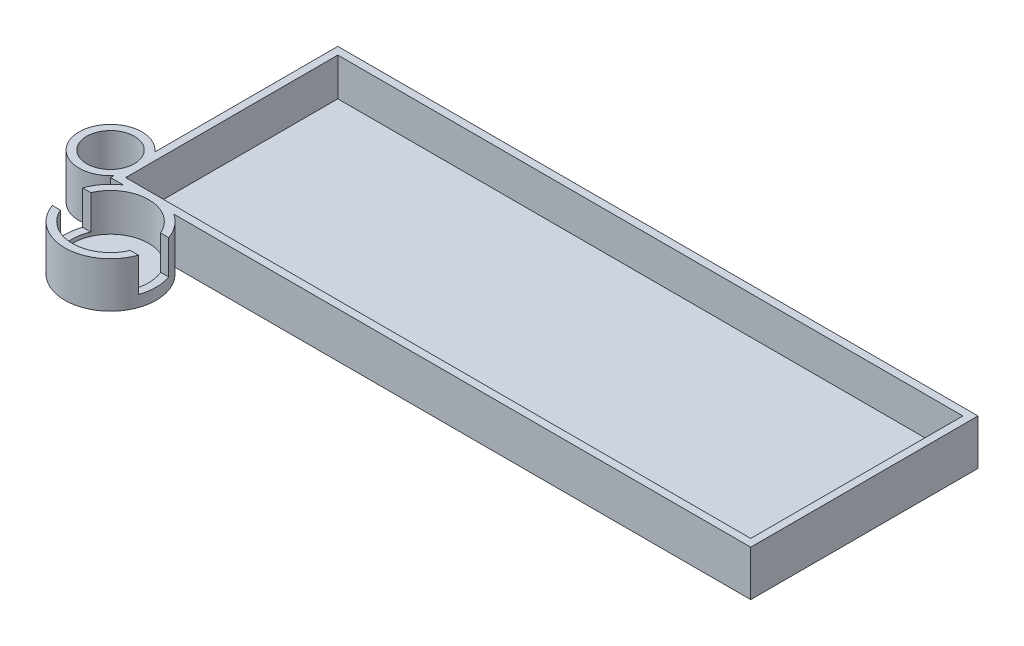
from build123d import *

# Parameters (mm, degrees)
SKETCH_1_W          = 165
SKETCH_1_H          = 56
EXTRUDE_1_DEPTH     = 2
SKETCH_3_W          = 169
SKETCH_3_H          = 60
SKETCH_3_W_2        = 165
SKETCH_3_H_2        = 56
EXTRUDE_2_DEPTH     = 12
SKETCH_4_R          = 10.05
EXTRUDE_3_DEPTH     = 2
SKETCH_5_R          = 12.05
SKETCH_5_R_2        = 10.05
EXTRUDE_4_DEPTH     = 12
SKETCH_6_W          = 46.432971474
SKETCH_6_H          = 8
CUT_EXTRUDE_1_DEPTH = 9
SKETCH_7_R          = 6.3
EXTRUDE_5_DEPTH     = 2
SKETCH_8_R          = 8.3
SKETCH_8_R_2        = 6.3
EXTRUDE_6_DEPTH     = 12


with BuildPart() as part:
    # 草图1 → 凸台-拉伸1 (new body)
    with BuildSketch(Plane(origin=(0, 0, 0), x_dir=(1, 0, 0), z_dir=(0, 1, 0))):
        with Locations((82.5, -28)):
            Rectangle(SKETCH_1_W, SKETCH_1_H)
    extrude(amount=EXTRUDE_1_DEPTH)

    # 草图3 → 凸台-拉伸2 (add)
    with BuildSketch(Plane.XZ):
        with Locations((82.5, 28)):
            Rectangle(SKETCH_3_W, SKETCH_3_H)
        with Locations((82.5, 28)):
            Rectangle(SKETCH_3_W_2, SKETCH_3_H_2, mode=Mode.SUBTRACT)
    extrude(amount=-EXTRUDE_2_DEPTH)



with BuildPart() as body_2:
    # 草图4 → 凸台-拉伸3 (new body)
    with BuildSketch(Plane.XZ):
        with Locations(Location((8.05, 68.05, 0), (0, 0, 270))):
            Circle(SKETCH_4_R)
    extrude(amount=-EXTRUDE_3_DEPTH)


with BuildPart() as part_1:
    add(part.part)

    add(body_2.part)  # 凸台-拉伸4 merges body 2
    # 草图5 → 凸台-拉伸4 (add)
    with BuildSketch(Plane.XZ):
        with Locations((8.05, 68.05)):
            Circle(SKETCH_5_R)
        with Locations(Location((8.05, 68.05, 0), (0, 0, 270))):
            Circle(SKETCH_5_R_2, mode=Mode.SUBTRACT)
    extrude(amount=-EXTRUDE_4_DEPTH)

    # 草图6 → 切除-拉伸1 (cut)
    with BuildSketch(Plane(origin=(0, 12, 0), x_dir=(1, 0, 0), z_dir=(0, 1, 0))):
        with Locations((8.05, -68.05)):
            Rectangle(SKETCH_6_W, SKETCH_6_H)
    extrude(amount=-CUT_EXTRUDE_1_DEPTH, mode=Mode.SUBTRACT)



with BuildPart() as body_2_2:
    # 草图7 → 凸台-拉伸5 (new body)
    with BuildSketch(Plane.XZ):
        with Locations(Location((-8.3, 51.7, 0), (0, 0, 270))):
            Circle(SKETCH_7_R)
    extrude(amount=-EXTRUDE_5_DEPTH)


with BuildPart() as part_2:
    add(part_1.part)

    add(body_2_2.part)  # 凸台-拉伸6 merges body 2 2
    # 草图8 → 凸台-拉伸6 (add)
    with BuildSketch(Plane.XZ):
        with Locations((-8.3, 51.7)):
            Circle(SKETCH_8_R)
        with Locations(Location((-8.3, 51.7, 0), (0, 0, 270))):
            Circle(SKETCH_8_R_2, mode=Mode.SUBTRACT)
    extrude(amount=-EXTRUDE_6_DEPTH)


solid = part_2.part
